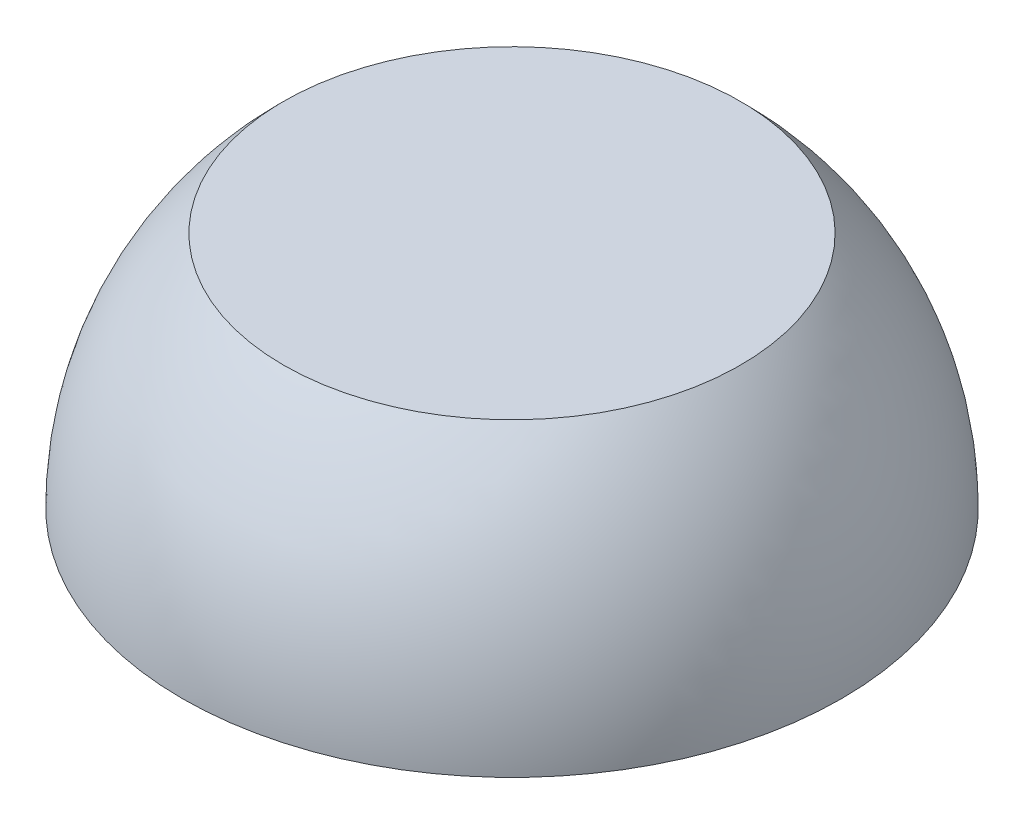
from build123d import *


with BuildPart() as part:
    # Sketch1 → Revolve1 (revolve)
    with BuildSketch(Plane.XY, mode=Mode.PRIVATE) as revolve1_sk:
        with BuildLine():
            Line((2.009740043, -5.332584421), (0, -5.332584421))
            Line((0, -5.332584421), (0, -7.427518825))
            Line((0, -7.427518825), (2.9, -7.427518825))
            ThreePointArc((2.9, -7.427518825), (2.668203085, -6.289393947), (2.009740043, -5.332584421))
        make_face()
    revolve(revolve1_sk.sketch.rotate(Axis((0, 0, 0), (0, -1, 0)), 90), axis=Axis((0, 0, 0), (0, -1, 0)))


solid = part.part
